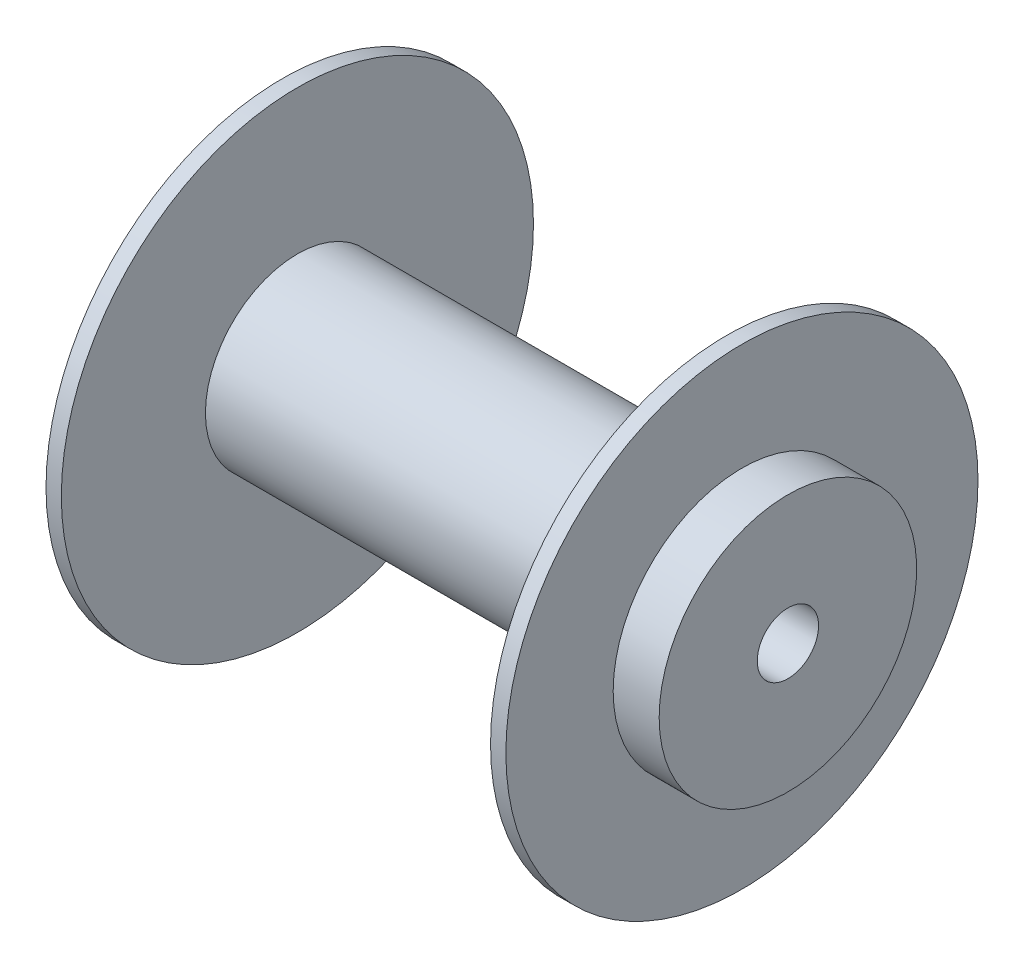
from build123d import *


with BuildPart() as part:
    # Esquisse1 → Révolution1 (revolve)
    with BuildSketch(Plane.XY, mode=Mode.PRIVATE) as r_volution1_sk:
        Polygon((180, 0), (160, 0), (160, 47), (165, 47), (165, 12), (180, 12), align=None)
        Polygon((20, 0), (0, 0), (0, -20), (180, -20), (180, 0), (160, 0), align=None)
        Polygon((20, 0), (0, 0), (0, 12), (15, 12), (15, 47), (20, 47), align=None)
    revolve(r_volution1_sk.sketch.rotate(Axis((0, -30, 0), (1, 0, 0)), 90), axis=Axis((0, -30, 0), (1, 0, 0)))


solid = part.part
